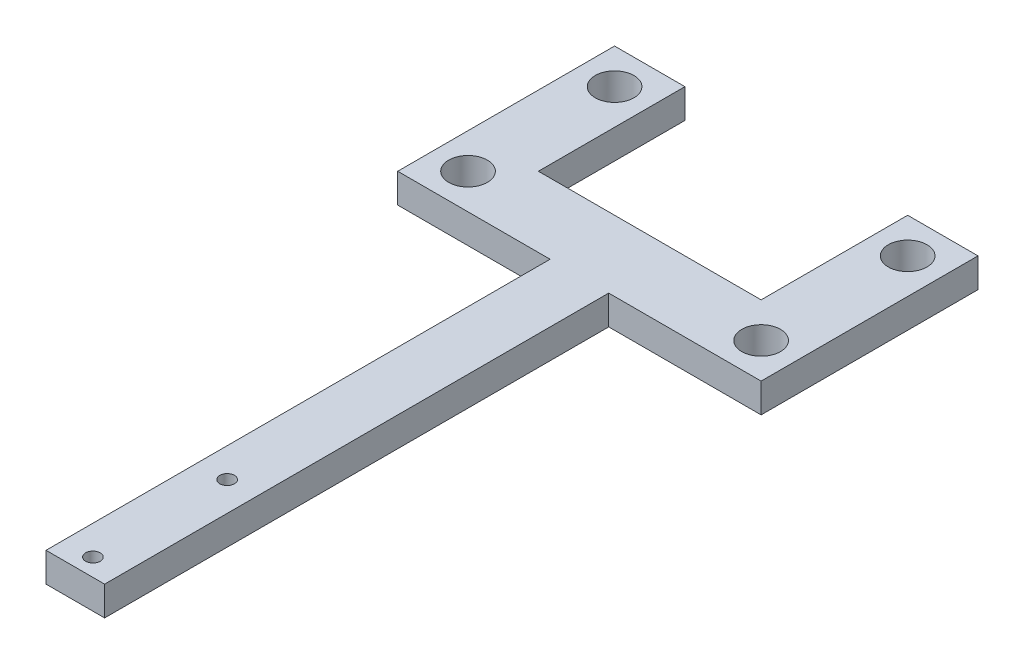
from build123d import *

# Parameters (mm, degrees)
SKETCH1_W             = 62
SKETCH1_H             = 123
EXTRUDE1_DEPTH        = 5
SKETCH2_W             = 38
SKETCH2_H             = 5
EXTRUDE2_DEPTH        = 25
SKETCH3_W             = 86
SKETCH3_H             = 5
EXTRUDE3_DEPTH        = 26
SKETCH4_W             = 86
SKETCH4_H             = 5
EXTRUDE4_DEPTH        = 26
LPATTERN1_COUNT       = 2
LPATTERN1_PITCH       = 25
LPATTERN1_COUNT_DIR2  = 2
LPATTERN1_PITCH_DIR2  = 50
M3X0_5_TAPPED_HOLE1_D = 2.5
LPATTERN2_COUNT       = 2
LPATTERN2_PITCH       = 22.9


with BuildPart() as part:
    # Sketch1 → Extrude1 (new body)
    with BuildSketch(Plane(origin=(0, 0, 0), x_dir=(1, 0, 0), z_dir=(0, 1, 0))):
        Rectangle(SKETCH1_W, SKETCH1_H)
    extrude(amount=EXTRUDE1_DEPTH)

    # Sketch2 → Extrude2 (cut)
    with BuildSketch(Plane(origin=(0, 0, -61.5), x_dir=(-1, 0, 0), z_dir=(0, 0, -1))):
        with Locations((0, 2.5)):
            Rectangle(SKETCH2_W, SKETCH2_H)
    extrude(amount=-EXTRUDE2_DEPTH, mode=Mode.SUBTRACT)

    # Sketch3 → Extrude3 (cut)
    with BuildSketch(Plane.ZY.offset(31)):
        with Locations((18.5, 2.5)):
            Rectangle(SKETCH3_W, SKETCH3_H)
    extrude(amount=-EXTRUDE3_DEPTH, mode=Mode.SUBTRACT)

    # Sketch4 → Extrude4 (cut)
    with BuildSketch(Plane(origin=(31, 0, 0), x_dir=(0, 0, -1), z_dir=(1, 0, 0))):
        with Locations((-18.5, 2.5)):
            Rectangle(SKETCH4_W, SKETCH4_H)
    extrude(amount=-EXTRUDE4_DEPTH, mode=Mode.SUBTRACT)

    # Sketch6 → M6 Clearance Hole1 (revolve, cut)
    with BuildSketch(Plane(origin=(-25, 5, -55.5), x_dir=(0, 0, 1), z_dir=(1, 0, 0))):
        Polygon((0, 0), (0, 11.982840043), (3.3, 10), (3.3, 0), align=None)
    m6_clearance_hole1 = revolve(axis=Axis((-25, 11.35, -55.5), (0, -1, 0)), mode=Mode.SUBTRACT)

    # LPattern1: M6 Clearance Hole1 2 × 2
    with Locations(*[(j * LPATTERN1_PITCH_DIR2, 0, i * LPATTERN1_PITCH) for i in range(LPATTERN1_COUNT) for j in range(LPATTERN1_COUNT_DIR2) if (i, j) != (0, 0)]):
        add(m6_clearance_hole1, mode=Mode.SUBTRACT)

    # M3x0.5 Tapped Hole1 (through all)
    with Locations(Plane(origin=(0, 5, 58.5), x_dir=(0, 0, 1), z_dir=(0, 1, 0))):
        with Locations((0, 0)):
            m3x0_5_tapped_hole1 = Hole(M3X0_5_TAPPED_HOLE1_D / 2)

    # LPattern2: M3x0.5 Tapped Hole1 ×2
    with Locations(*[(0, 0, -i * LPATTERN2_PITCH) for i in range(1, LPATTERN2_COUNT)]):
        add(m3x0_5_tapped_hole1, mode=Mode.SUBTRACT)


solid = part.part
